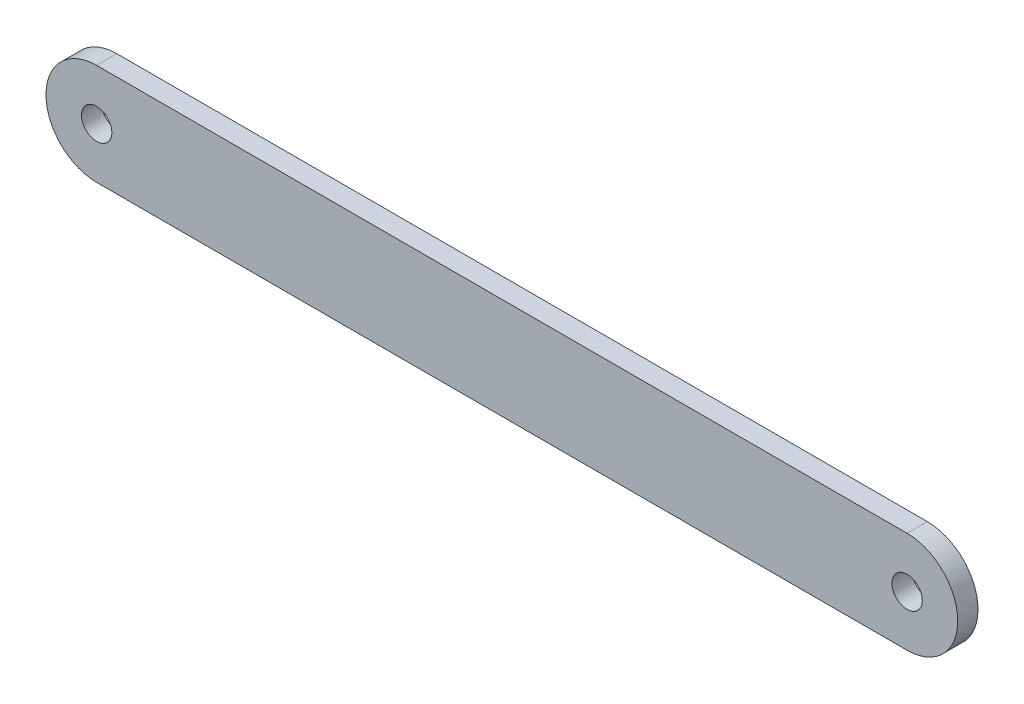
from build123d import *

# Parameters (mm, degrees)
ESQUISSE1_R        = 1.5
BOSS_EXTRU_1_DEPTH = 2


with BuildPart() as part:
    # Esquisse1 → Boss.-Extru.1 (new body)
    with BuildSketch(Plane.XY):
        with BuildLine():
            Line((-40, 5), (40, 5))
            ThreePointArc((40, 5), (45, 0), (40, -5))
            Line((40, -5), (-40, -5))
            ThreePointArc((-40, -5), (-45, 0), (-40, 5))
        make_face()
        with Locations((-40, 0)):
            Circle(ESQUISSE1_R, mode=Mode.SUBTRACT)
        with Locations((40, 0)):
            Circle(ESQUISSE1_R, mode=Mode.SUBTRACT)
    extrude(amount=BOSS_EXTRU_1_DEPTH)


solid = part.part
